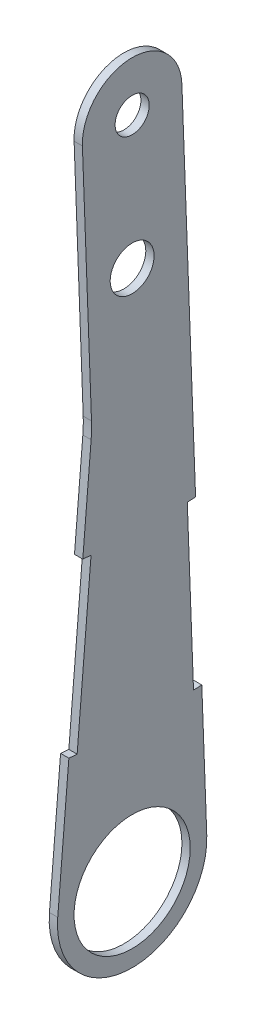
from build123d import *

# Parameters (mm, degrees)
SKETCH1_R               = 11.1125
BOSS_EXTRUDE1_DEPTH     = 1.5875
F_1_4_CLEARANCE_HOLE1_D = 6.5278
M8_CLEARANCE_HOLE1_D    = 8.4


with BuildPart() as part:
    # Sketch1 → Boss-Extrude1 (new body)
    with BuildSketch(Plane(origin=(0, 0, 0), x_dir=(0, 0, -1), z_dir=(1, 0, 0))):
        with BuildLine():
            Line((9.518300378, 127.3571875), (12.134325567, 57.645583519))
            Line((12.134325567, 57.645583519), (10.547942171, 57.586052269))
            Line((10.547942171, 57.586052269), (11.738567171, 25.858384342))
            Line((11.738567171, 25.858384342), (13.324950567, 25.917915592))
            Line((13.324950567, 25.917915592), (14.277450567, 0.53578125))
            ThreePointArc((14.277450567, 0.53578125), (-0.331752192, -14.283647879), (-14.237180291, 1.198062439))
            Line((-14.237180291, 1.198062439), (-12.107291511, 26.508605179))
            Line((-12.107291511, 26.508605179), (-10.52538259, 26.37548713))
            Line((-10.52538259, 26.37548713), (-7.863021614, 58.013665555))
            Line((-7.863021614, 58.013665555), (-9.444930535, 58.146783604))
            Line((-9.444930535, 58.146783604), (-7.84751395, 77.129690658))
            ThreePointArc((-7.84751395, 77.129690658), (-7.764904905, 78.669797764), (-7.775922348, 80.212079439))
            Line((-7.775922348, 80.212079439), (-9.518300378, 126.6428125))
            ThreePointArc((-9.518300378, 126.6428125), (-0.3571875, 136.518300378), (9.518300378, 127.3571875))
        make_face()
        Circle(SKETCH1_R, mode=Mode.SUBTRACT)
    extrude(amount=BOSS_EXTRUDE1_DEPTH)

    # 1/4 Clearance Hole1 (through all)
    with Locations(Plane(origin=(1.5875, 0, 0), x_dir=(0, 0, -1), z_dir=(1, 0, 0))):
        with Locations((0, 127)):
            Hole(F_1_4_CLEARANCE_HOLE1_D / 2)

    # M8 Clearance Hole1 (through all)
    with Locations(Plane(origin=(1.5875, 0, 0), x_dir=(0, 0, -1), z_dir=(1, 0, 0))):
        with Locations((0, 101.6)):
            Hole(M8_CLEARANCE_HOLE1_D / 2)


solid = part.part
